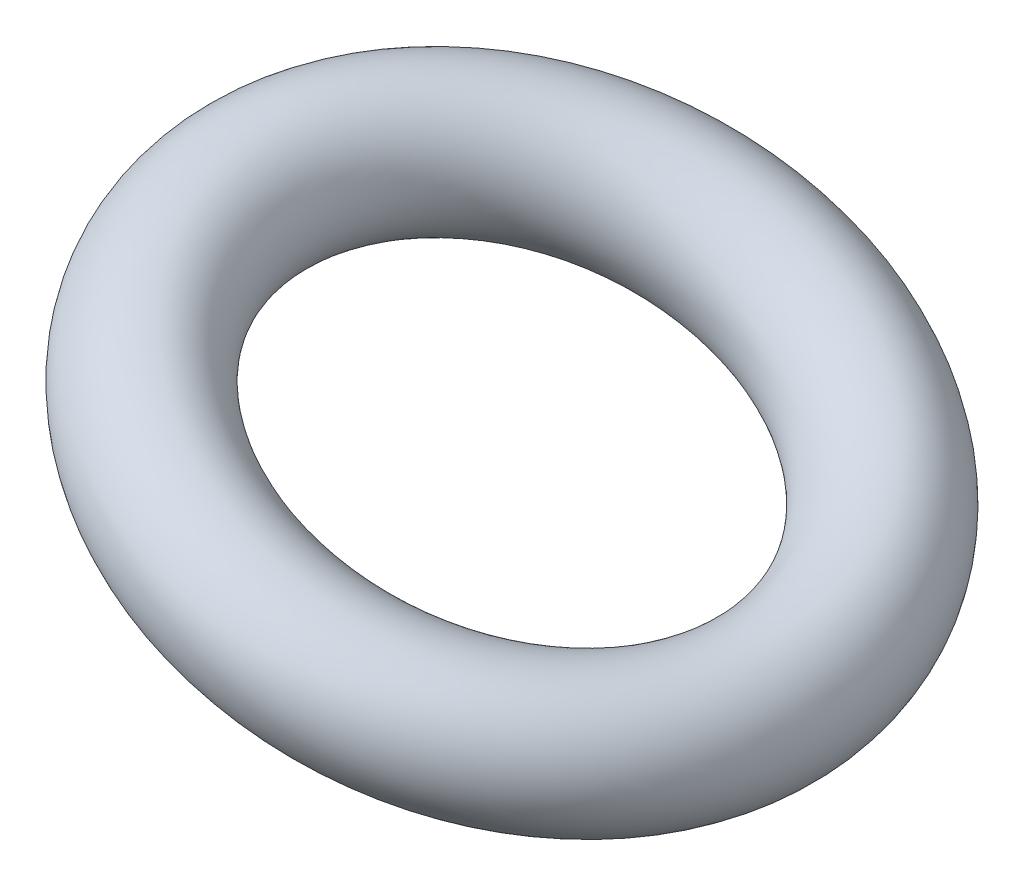
from build123d import *

# Parameters (mm, degrees)
SKETCH1_R = 2.5


with BuildPart() as part:
    # Sketch1 → Revolve2 (revolve)
    with BuildSketch(Plane.XY):
        with Locations((-30.773408748, 14.236715055)):
            Circle(SKETCH1_R)
    revolve(axis=Axis((-15.299927627, 26.76764076, 0), (-0.35593168157658023, -0.9345119785481982, 0)))


solid = part.part
